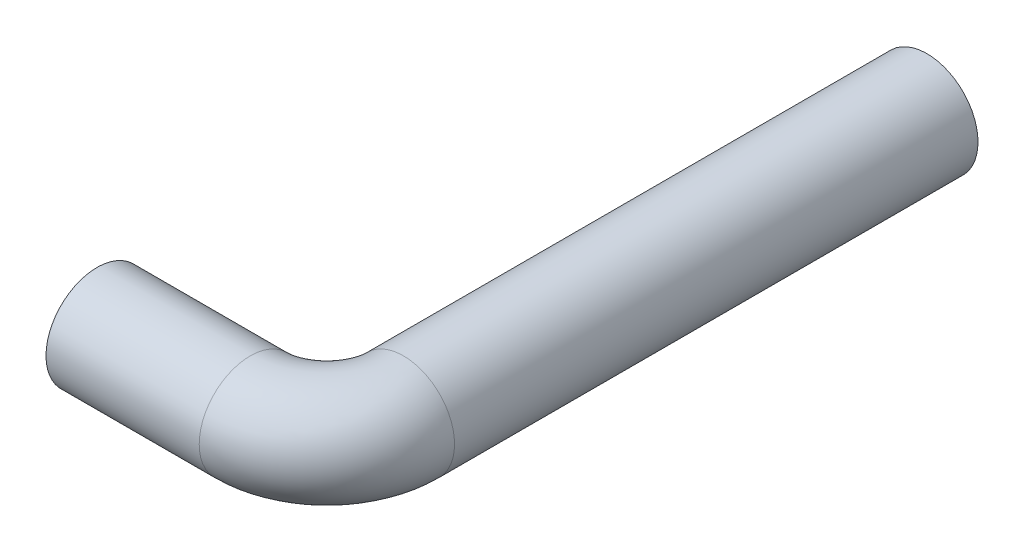
from build123d import *

# Parameters (mm, degrees)
TUBE_PROFILE_R   = 4
TUBE_PROFILE_R_2 = 3


with BuildPart() as part:
    # Tube: sweep along a curve in space
    with BuildLine() as tube_path:
        Line((162, 21, 95), (174, 21, 95))
        ThreePointArc((180, 21, 89), (178.242640687, 21, 93.242640687), (174, 21, 95))
        Line((180, 21, 89), (180, 21, 48))
    # Tube profile (on start of the path) → Tube (sweep)
    with BuildSketch(Plane(origin=(162, 21, 95), x_dir=(0, 0, 1), z_dir=(1, 0, 0))):
        Circle(TUBE_PROFILE_R)
        Circle(TUBE_PROFILE_R_2, mode=Mode.SUBTRACT)
    sweep(path=tube_path.line)


solid = part.part
